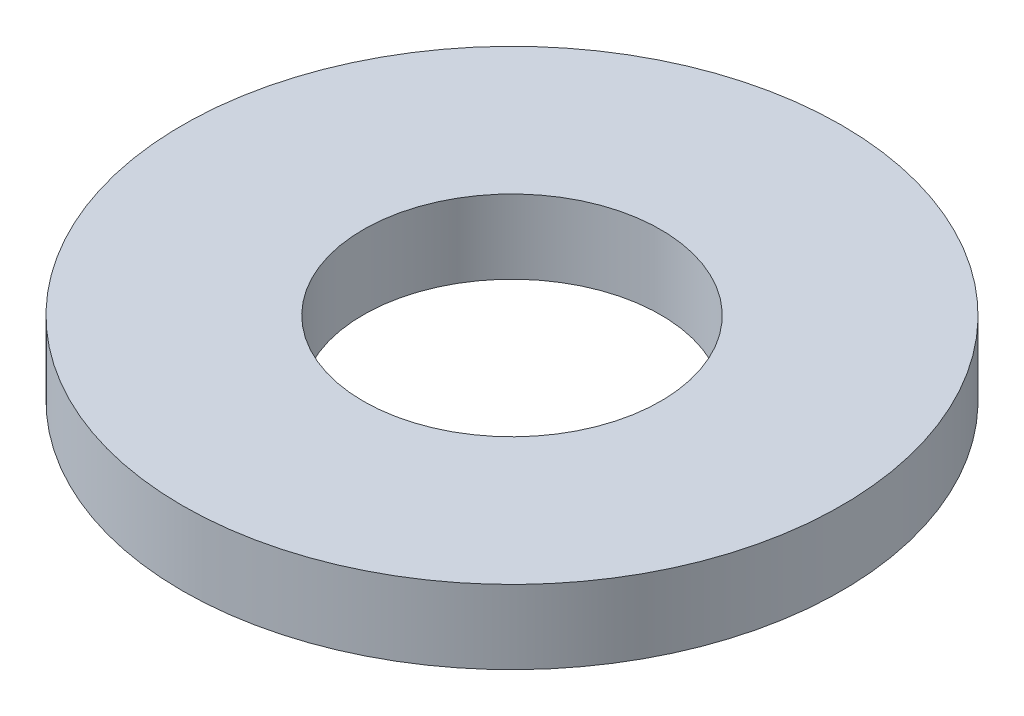
from build123d import *

# Parameters (mm, degrees)
SKETCH1_R           = 7.9375
BOSS_EXTRUDE1_DEPTH = 1.778
SKETCH5_R           = 3.5814
CUT_EXTRUDE1_DEPTH  = 12.365258312


with BuildPart() as part:
    # Sketch1 → Boss-Extrude1 (new body)
    with BuildSketch(Plane(origin=(0, 0, 0), x_dir=(1, 0, 0), z_dir=(0, 1, 0))):
        with Locations(Location((0, 0, 0), (0, 0, 270))):
            Circle(SKETCH1_R)
    extrude(amount=BOSS_EXTRUDE1_DEPTH)

    # Sketch5 → Cut-Extrude1 (cut, through all)
    with BuildSketch(Plane(origin=(0, 1.778, 0), x_dir=(-1, 0, 0), z_dir=(0, 1, 0))):
        with Locations(Location((0, 0, 0), (0, 0, 90))):
            Circle(SKETCH5_R)
    extrude(amount=-CUT_EXTRUDE1_DEPTH, mode=Mode.SUBTRACT)


solid = part.part
